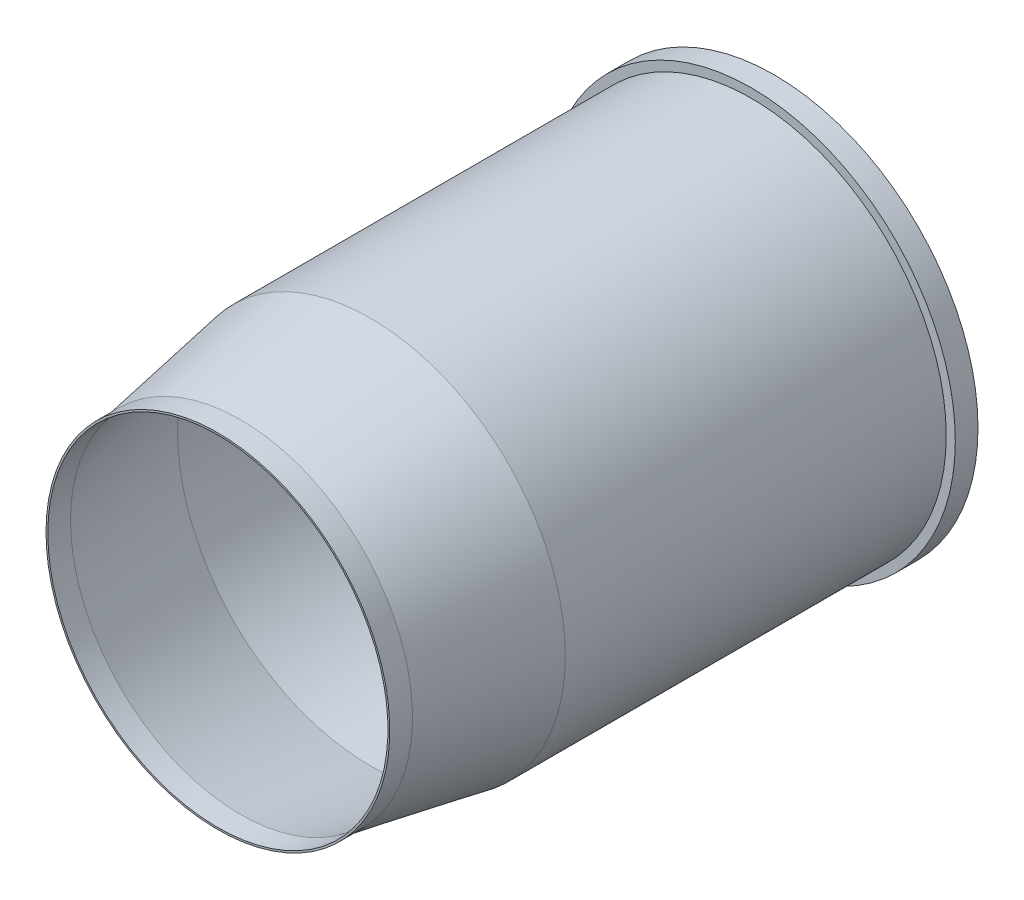
from build123d import *


with BuildPart() as part:
    # Sketch1 → Revolve1 (revolve)
    with BuildSketch(Plane(origin=(0, 0, 0), x_dir=(0, 0, -1), z_dir=(1, 0, 0)), mode=Mode.PRIVATE) as revolve1_sk:
        Polygon((0, 42.5), (-88.877040656, 42.5), (-117.5, 37.453), (-122.5, 37.453), (-122.5, 37.853), (-117.5, 37.853), (-88.877040656, 42.9), (-5, 42.9), (-5, 44.9), (0, 44.9), align=None)
    revolve(revolve1_sk.sketch.rotate(Axis((0, 0, 0), (0, 0, 1)), 90), axis=Axis((0, 0, 0), (0, 0, 1)))


solid = part.part
